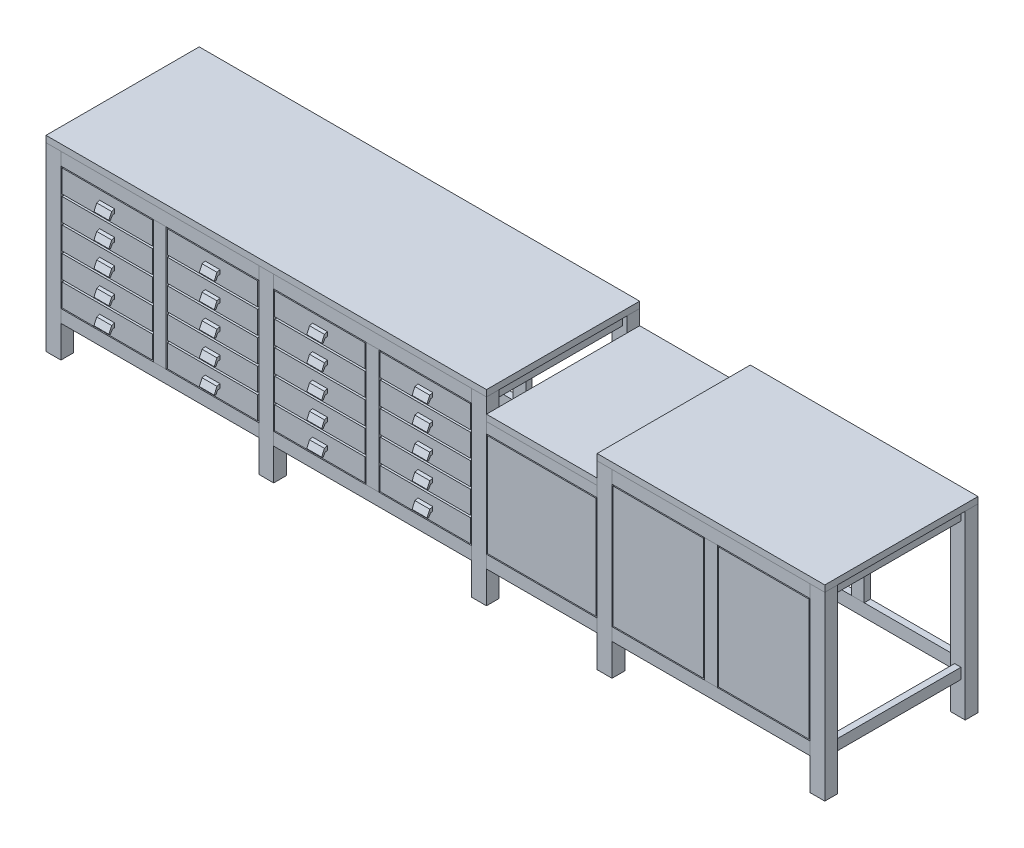
from build123d import *

# Parameters (mm, degrees)
ESQUISSE1_W             = 70
ESQUISSE1_H             = 850
BOSS_EXTRU_1_DEPTH      = 60
BOSS_EXTRU_1_2_DEPTH    = 60
BOSS_EXTRU_1_3_DEPTH    = 60
BOSS_EXTRU_1_4_DEPTH    = 60
BOSS_EXTRU_1_5_DEPTH    = 60
ESQUISSE2_W             = 930
ESQUISSE2_H             = 60
BOSS_EXTRU_2_DEPTH      = 35
BOSS_EXTRU_2_2_DEPTH    = 35
BOSS_EXTRU_2_3_DEPTH    = 35
BOSS_EXTRU_2_4_DEPTH    = 35
BOSS_EXTRU_2_5_DEPTH    = 35
BOSS_EXTRU_2_6_DEPTH    = 35
ESQUISSE2_W_2           = 520
ESQUISSE2_H_2           = 50
BOSS_EXTRU_2_7_DEPTH    = 35
BOSS_EXTRU_2_8_DEPTH    = 35
ESQUISSE3_W             = 30
ESQUISSE3_H             = 50
BOSS_EXTRU_3_DEPTH      = 600
BOSS_EXTRU_3_2_DEPTH    = 600
BOSS_EXTRU_3_3_DEPTH    = 600
BOSS_EXTRU_3_4_DEPTH    = 600
BOSS_EXTRU_3_5_DEPTH    = 600
BOSS_EXTRU_3_6_DEPTH    = 600
BOSS_EXTRU_3_7_DEPTH    = 600
BOSS_EXTRU_3_8_DEPTH    = 600
BOSS_EXTRU_3_9_DEPTH    = 600
BOSS_EXTRU_3_10_DEPTH   = 600
BOSS_EXTRU_4_START      = -600
ESQUISSE1_2_W           = 70
ESQUISSE1_2_H           = 850
BOSS_EXTRU_4_DEPTH      = 60
BOSS_EXTRU_4_2_DEPTH    = 60
BOSS_EXTRU_4_3_DEPTH    = 60
BOSS_EXTRU_4_4_DEPTH    = 60
BOSS_EXTRU_4_5_DEPTH    = 60
BOSS_EXTRU_5_START      = -720
ESQUISSE2_2_W           = 930
ESQUISSE2_2_H           = 60
BOSS_EXTRU_5_DEPTH      = 30
BOSS_EXTRU_5_2_DEPTH    = 30
BOSS_EXTRU_5_3_DEPTH    = 30
BOSS_EXTRU_5_4_DEPTH    = 30
BOSS_EXTRU_5_5_DEPTH    = 30
BOSS_EXTRU_5_6_DEPTH    = 30
ESQUISSE2_2_W_2         = 520
ESQUISSE2_2_H_2         = 50
BOSS_EXTRU_5_7_DEPTH    = 30
BOSS_EXTRU_5_8_DEPTH    = 30
ESQUISSE4_W             = 2070
ESQUISSE4_H             = 720
BOSS_EXTRU_6_DEPTH      = 30
ESQUISSE4_W_2           = 1070
BOSS_EXTRU_6_2_DEPTH    = 30
ESQUISSE5_W             = 520
ESQUISSE5_H             = 720
BOSS_EXTRU_7_DEPTH      = 30
ESQUISSE6_W             = 60
ESQUISSE6_H             = 580
BOSS_EXTRU_8_DEPTH      = 35
BOSS_EXTRU_8_2_DEPTH    = 35
BOSS_EXTRU_8_3_DEPTH    = 35
BOSS_EXTRU_10_START     = -720
ESQUISSE6_2_W           = 60
ESQUISSE6_2_H           = 580
BOSS_EXTRU_10_DEPTH     = 30
BOSS_EXTRU_10_2_DEPTH   = 30
BOSS_EXTRU_10_3_DEPTH   = 30
ESQUISSE7_W             = 425
ESQUISSE7_H             = 106
BOSS_EXTRU_11_DEPTH     = 18
BOSS_EXTRU_11_2_DEPTH   = 18
BOSS_EXTRU_11_3_DEPTH   = 18
BOSS_EXTRU_11_4_DEPTH   = 18
BOSS_EXTRU_11_5_DEPTH   = 18
BOSS_EXTRU_11_6_DEPTH   = 18
BOSS_EXTRU_11_7_DEPTH   = 18
BOSS_EXTRU_11_8_DEPTH   = 18
BOSS_EXTRU_11_9_DEPTH   = 18
BOSS_EXTRU_11_10_DEPTH  = 18
BOSS_EXTRU_11_11_DEPTH  = 18
BOSS_EXTRU_11_12_DEPTH  = 18
BOSS_EXTRU_11_13_DEPTH  = 18
BOSS_EXTRU_11_14_DEPTH  = 18
BOSS_EXTRU_11_15_DEPTH  = 18
BOSS_EXTRU_11_16_DEPTH  = 18
BOSS_EXTRU_11_17_DEPTH  = 18
BOSS_EXTRU_11_18_DEPTH  = 18
BOSS_EXTRU_11_19_DEPTH  = 18
BOSS_EXTRU_11_20_DEPTH  = 18
ESQUISSE7_W_2           = 510
ESQUISSE7_H_2           = 480
BOSS_EXTRU_11_21_DEPTH  = 18
ESQUISSE7_H_3           = 570
BOSS_EXTRU_11_22_DEPTH  = 18
BOSS_EXTRU_11_23_DEPTH  = 18
BOSS_EXTRU_12_DEPTH     = 1995
BOSS_EXTRU_12_2_DEPTH   = 1995
BOSS_EXTRU_12_3_DEPTH   = 1995
BOSS_EXTRU_12_4_DEPTH   = 1995
BOSS_EXTRU_12_5_DEPTH   = 1995
ESQUISSE9_W             = 252.5
ESQUISSE9_H             = 730
ESQUISSE9_W_2           = 425
ENL_V_MAT_EXTRU_2_DEPTH = 3833.544846443


with BuildPart() as part:
    # Esquisse1 → Boss.-Extru.1 (new body)
    with BuildSketch(Plane.XY):
        with Locations((35, 425)):
            Rectangle(ESQUISSE1_W, ESQUISSE1_H)
    extrude(amount=BOSS_EXTRU_1_DEPTH)


with BuildPart() as body_2:
    # Esquisse1 → Boss.-Extru.1 2 (new body)
    with BuildSketch(Plane.XY):
        with Locations((1035, 425)):
            Rectangle(ESQUISSE1_W, ESQUISSE1_H)
    extrude(amount=BOSS_EXTRU_1_2_DEPTH)


with BuildPart() as body_3:
    # Esquisse1 → Boss.-Extru.1 3 (new body)
    with BuildSketch(Plane.XY):
        with Locations((2035, 425)):
            Rectangle(ESQUISSE1_W, ESQUISSE1_H)
    extrude(amount=BOSS_EXTRU_1_3_DEPTH)


with BuildPart() as body_4:
    # Esquisse1 → Boss.-Extru.1 4 (new body)
    with BuildSketch(Plane.XY):
        with Locations((2625, 425)):
            Rectangle(ESQUISSE1_W, ESQUISSE1_H)
    extrude(amount=BOSS_EXTRU_1_4_DEPTH)


with BuildPart() as body_5:
    # Esquisse1 → Boss.-Extru.1 5 (new body)
    with BuildSketch(Plane.XY):
        with Locations((3625, 425)):
            Rectangle(ESQUISSE1_W, ESQUISSE1_H)
    extrude(amount=BOSS_EXTRU_1_5_DEPTH)


with BuildPart() as body_6:
    # Esquisse2 → Boss.-Extru.2 (new body)
    with BuildSketch(Plane.XY.offset(60)):
        with Locations((535, 820)):
            Rectangle(ESQUISSE2_W, ESQUISSE2_H)
    extrude(amount=-BOSS_EXTRU_2_DEPTH)


with BuildPart() as body_7:
    # Esquisse2 → Boss.-Extru.2 2 (new body)
    with BuildSketch(Plane.XY.offset(60)):
        with Locations((1535, 820)):
            Rectangle(ESQUISSE2_W, ESQUISSE2_H)
    extrude(amount=-BOSS_EXTRU_2_2_DEPTH)


with BuildPart() as body_8:
    # Esquisse2 → Boss.-Extru.2 3 (new body)
    with BuildSketch(Plane.XY.offset(60)):
        with Locations((3125, 820)):
            Rectangle(ESQUISSE2_W, ESQUISSE2_H)
    extrude(amount=-BOSS_EXTRU_2_3_DEPTH)


with BuildPart() as body_9:
    # Esquisse2 → Boss.-Extru.2 4 (new body)
    with BuildSketch(Plane.XY.offset(60)):
        with Locations((3125, 180)):
            Rectangle(ESQUISSE2_W, ESQUISSE2_H)
    extrude(amount=-BOSS_EXTRU_2_4_DEPTH)


with BuildPart() as body_10:
    # Esquisse2 → Boss.-Extru.2 5 (new body)
    with BuildSketch(Plane.XY.offset(60)):
        with Locations((1535, 180)):
            Rectangle(ESQUISSE2_W, ESQUISSE2_H)
    extrude(amount=-BOSS_EXTRU_2_5_DEPTH)


with BuildPart() as body_11:
    # Esquisse2 → Boss.-Extru.2 6 (new body)
    with BuildSketch(Plane.XY.offset(60)):
        with Locations((535, 180)):
            Rectangle(ESQUISSE2_W, ESQUISSE2_H)
    extrude(amount=-BOSS_EXTRU_2_6_DEPTH)


with BuildPart() as body_12:
    # Esquisse2 → Boss.-Extru.2 7 (new body)
    with BuildSketch(Plane.XY.offset(60)):
        with Locations((2330, 725)):
            Rectangle(ESQUISSE2_W_2, ESQUISSE2_H_2)
    extrude(amount=-BOSS_EXTRU_2_7_DEPTH)


with BuildPart() as body_13:
    # Esquisse2 → Boss.-Extru.2 8 (new body)
    with BuildSketch(Plane.XY.offset(60)):
        with Locations((2330, 180)):
            Rectangle(ESQUISSE2_W_2, ESQUISSE2_H)
    extrude(amount=-BOSS_EXTRU_2_8_DEPTH)


with BuildPart() as body_14:
    # Esquisse3 → Boss.-Extru.3 (new body)
    with BuildSketch(Plane(origin=(0, 0, 0), x_dir=(-1, 0, 0), z_dir=(0, 0, -1))):
        with Locations((-3625, 825)):
            Rectangle(ESQUISSE3_W, ESQUISSE3_H)
    extrude(amount=BOSS_EXTRU_3_DEPTH)


with BuildPart() as body_15:
    # Esquisse3 → Boss.-Extru.3 2 (new body)
    with BuildSketch(Plane(origin=(0, 0, 0), x_dir=(-1, 0, 0), z_dir=(0, 0, -1))):
        with Locations((-3625, 180)):
            Rectangle(ESQUISSE3_W, ESQUISSE3_H)
    extrude(amount=BOSS_EXTRU_3_2_DEPTH)


with BuildPart() as body_16:
    # Esquisse3 → Boss.-Extru.3 3 (new body)
    with BuildSketch(Plane(origin=(0, 0, 0), x_dir=(-1, 0, 0), z_dir=(0, 0, -1))):
        with Locations((-2625, 180)):
            Rectangle(ESQUISSE3_W, ESQUISSE3_H)
    extrude(amount=BOSS_EXTRU_3_3_DEPTH)


with BuildPart() as body_17:
    # Esquisse3 → Boss.-Extru.3 4 (new body)
    with BuildSketch(Plane(origin=(0, 0, 0), x_dir=(-1, 0, 0), z_dir=(0, 0, -1))):
        with Locations((-2625, 825)):
            Rectangle(ESQUISSE3_W, ESQUISSE3_H)
    extrude(amount=BOSS_EXTRU_3_4_DEPTH)


with BuildPart() as body_18:
    # Esquisse3 → Boss.-Extru.3 5 (new body)
    with BuildSketch(Plane(origin=(0, 0, 0), x_dir=(-1, 0, 0), z_dir=(0, 0, -1))):
        with Locations((-2035, 825)):
            Rectangle(ESQUISSE3_W, ESQUISSE3_H)
    extrude(amount=BOSS_EXTRU_3_5_DEPTH)


with BuildPart() as body_19:
    # Esquisse3 → Boss.-Extru.3 6 (new body)
    with BuildSketch(Plane(origin=(0, 0, 0), x_dir=(-1, 0, 0), z_dir=(0, 0, -1))):
        with Locations((-2035, 180)):
            Rectangle(ESQUISSE3_W, ESQUISSE3_H)
    extrude(amount=BOSS_EXTRU_3_6_DEPTH)


with BuildPart() as body_20:
    # Esquisse3 → Boss.-Extru.3 7 (new body)
    with BuildSketch(Plane(origin=(0, 0, 0), x_dir=(-1, 0, 0), z_dir=(0, 0, -1))):
        with Locations((-1035, 180)):
            Rectangle(ESQUISSE3_W, ESQUISSE3_H)
    extrude(amount=BOSS_EXTRU_3_7_DEPTH)


with BuildPart() as body_21:
    # Esquisse3 → Boss.-Extru.3 8 (new body)
    with BuildSketch(Plane(origin=(0, 0, 0), x_dir=(-1, 0, 0), z_dir=(0, 0, -1))):
        with Locations((-1035, 825)):
            Rectangle(ESQUISSE3_W, ESQUISSE3_H)
    extrude(amount=BOSS_EXTRU_3_8_DEPTH)


with BuildPart() as body_22:
    # Esquisse3 → Boss.-Extru.3 9 (new body)
    with BuildSketch(Plane(origin=(0, 0, 0), x_dir=(-1, 0, 0), z_dir=(0, 0, -1))):
        with Locations((-35, 825)):
            Rectangle(ESQUISSE3_W, ESQUISSE3_H)
    extrude(amount=BOSS_EXTRU_3_9_DEPTH)


with BuildPart() as body_23:
    # Esquisse3 → Boss.-Extru.3 10 (new body)
    with BuildSketch(Plane(origin=(0, 0, 0), x_dir=(-1, 0, 0), z_dir=(0, 0, -1))):
        with Locations((-35, 180)):
            Rectangle(ESQUISSE3_W, ESQUISSE3_H)
    extrude(amount=BOSS_EXTRU_3_10_DEPTH)


with BuildPart() as body_24:
    # Esquisse1<2> → Boss.-Extru.4 (new body)
    with BuildSketch(Plane.XY.offset(BOSS_EXTRU_4_START)):
        with Locations((35, 425)):
            Rectangle(ESQUISSE1_2_W, ESQUISSE1_2_H)
    extrude(amount=-BOSS_EXTRU_4_DEPTH)


with BuildPart() as body_25:
    # Esquisse1<2> → Boss.-Extru.4 2 (new body)
    with BuildSketch(Plane.XY.offset(BOSS_EXTRU_4_START)):
        with Locations((1035, 425)):
            Rectangle(ESQUISSE1_2_W, ESQUISSE1_2_H)
    extrude(amount=-BOSS_EXTRU_4_2_DEPTH)


with BuildPart() as body_26:
    # Esquisse1<2> → Boss.-Extru.4 3 (new body)
    with BuildSketch(Plane.XY.offset(BOSS_EXTRU_4_START)):
        with Locations((2035, 425)):
            Rectangle(ESQUISSE1_2_W, ESQUISSE1_2_H)
    extrude(amount=-BOSS_EXTRU_4_3_DEPTH)


with BuildPart() as body_27:
    # Esquisse1<2> → Boss.-Extru.4 4 (new body)
    with BuildSketch(Plane.XY.offset(BOSS_EXTRU_4_START)):
        with Locations((2625, 425)):
            Rectangle(ESQUISSE1_2_W, ESQUISSE1_2_H)
    extrude(amount=-BOSS_EXTRU_4_4_DEPTH)


with BuildPart() as body_28:
    # Esquisse1<2> → Boss.-Extru.4 5 (new body)
    with BuildSketch(Plane.XY.offset(BOSS_EXTRU_4_START)):
        with Locations((3625, 425)):
            Rectangle(ESQUISSE1_2_W, ESQUISSE1_2_H)
    extrude(amount=-BOSS_EXTRU_4_5_DEPTH)


with BuildPart() as body_29:
    # Esquisse2<2> → Boss.-Extru.5 (new body)
    with BuildSketch(Plane.XY.offset(60).offset(BOSS_EXTRU_5_START)):
        with Locations((535, 820)):
            Rectangle(ESQUISSE2_2_W, ESQUISSE2_2_H)
    extrude(amount=BOSS_EXTRU_5_DEPTH)


with BuildPart() as body_30:
    # Esquisse2<2> → Boss.-Extru.5 2 (new body)
    with BuildSketch(Plane.XY.offset(60).offset(BOSS_EXTRU_5_START)):
        with Locations((1535, 820)):
            Rectangle(ESQUISSE2_2_W, ESQUISSE2_2_H)
    extrude(amount=BOSS_EXTRU_5_2_DEPTH)


with BuildPart() as body_31:
    # Esquisse2<2> → Boss.-Extru.5 3 (new body)
    with BuildSketch(Plane.XY.offset(60).offset(BOSS_EXTRU_5_START)):
        with Locations((3125, 820)):
            Rectangle(ESQUISSE2_2_W, ESQUISSE2_2_H)
    extrude(amount=BOSS_EXTRU_5_3_DEPTH)


with BuildPart() as body_32:
    # Esquisse2<2> → Boss.-Extru.5 4 (new body)
    with BuildSketch(Plane.XY.offset(60).offset(BOSS_EXTRU_5_START)):
        with Locations((3125, 180)):
            Rectangle(ESQUISSE2_2_W, ESQUISSE2_2_H)
    extrude(amount=BOSS_EXTRU_5_4_DEPTH)


with BuildPart() as body_33:
    # Esquisse2<2> → Boss.-Extru.5 5 (new body)
    with BuildSketch(Plane.XY.offset(60).offset(BOSS_EXTRU_5_START)):
        with Locations((1535, 180)):
            Rectangle(ESQUISSE2_2_W, ESQUISSE2_2_H)
    extrude(amount=BOSS_EXTRU_5_5_DEPTH)


with BuildPart() as body_34:
    # Esquisse2<2> → Boss.-Extru.5 6 (new body)
    with BuildSketch(Plane.XY.offset(60).offset(BOSS_EXTRU_5_START)):
        with Locations((535, 180)):
            Rectangle(ESQUISSE2_2_W, ESQUISSE2_2_H)
    extrude(amount=BOSS_EXTRU_5_6_DEPTH)


with BuildPart() as body_35:
    # Esquisse2<2> → Boss.-Extru.5 7 (new body)
    with BuildSketch(Plane.XY.offset(60).offset(BOSS_EXTRU_5_START)):
        with Locations((2330, 725)):
            Rectangle(ESQUISSE2_2_W_2, ESQUISSE2_2_H_2)
    extrude(amount=BOSS_EXTRU_5_7_DEPTH)


with BuildPart() as body_36:
    # Esquisse2<2> → Boss.-Extru.5 8 (new body)
    with BuildSketch(Plane.XY.offset(60).offset(BOSS_EXTRU_5_START)):
        with Locations((2330, 180)):
            Rectangle(ESQUISSE2_2_W_2, ESQUISSE2_2_H)
    extrude(amount=BOSS_EXTRU_5_8_DEPTH)


with BuildPart() as body_37:
    # Esquisse4 → Boss.-Extru.6 (new body)
    with BuildSketch(Plane(origin=(0, 850, 0), x_dir=(1, 0, 0), z_dir=(0, 1, 0))):
        with Locations((1035, 300)):
            Rectangle(ESQUISSE4_W, ESQUISSE4_H)
    extrude(amount=BOSS_EXTRU_6_DEPTH)


with BuildPart() as body_38:
    # Esquisse4 → Boss.-Extru.6 2 (new body)
    with BuildSketch(Plane(origin=(0, 850, 0), x_dir=(1, 0, 0), z_dir=(0, 1, 0))):
        with Locations((3125, 300)):
            Rectangle(ESQUISSE4_W_2, ESQUISSE4_H)
    extrude(amount=BOSS_EXTRU_6_2_DEPTH)


with BuildPart() as body_39:
    # Esquisse5 → Boss.-Extru.7 (new body)
    with BuildSketch(Plane(origin=(0, 750, 0), x_dir=(1, 0, 0), z_dir=(0, 1, 0))):
        with Locations((2330, 300)):
            Rectangle(ESQUISSE5_W, ESQUISSE5_H)
    extrude(amount=BOSS_EXTRU_7_DEPTH)


with BuildPart() as body_40:
    # Esquisse6 → Boss.-Extru.8 (new body)
    with BuildSketch(Plane.XY.offset(60)):
        with Locations((535, 500)):
            Rectangle(ESQUISSE6_W, ESQUISSE6_H)
    extrude(amount=-BOSS_EXTRU_8_DEPTH)


with BuildPart() as body_41:
    # Esquisse6 → Boss.-Extru.8 2 (new body)
    with BuildSketch(Plane.XY.offset(60)):
        with Locations((1535, 500)):
            Rectangle(ESQUISSE6_W, ESQUISSE6_H)
    extrude(amount=-BOSS_EXTRU_8_2_DEPTH)


with BuildPart() as body_42:
    # Esquisse6 → Boss.-Extru.8 3 (new body)
    with BuildSketch(Plane.XY.offset(60)):
        with Locations((3125, 500)):
            Rectangle(ESQUISSE6_W, ESQUISSE6_H)
    extrude(amount=-BOSS_EXTRU_8_3_DEPTH)


with BuildPart() as body_43:
    # Esquisse6<2> → Boss.-Extru.10 (new body)
    with BuildSketch(Plane.XY.offset(60).offset(BOSS_EXTRU_10_START)):
        with Locations((535, 500)):
            Rectangle(ESQUISSE6_2_W, ESQUISSE6_2_H)
    extrude(amount=BOSS_EXTRU_10_DEPTH)


with BuildPart() as body_44:
    # Esquisse6<2> → Boss.-Extru.10 2 (new body)
    with BuildSketch(Plane.XY.offset(60).offset(BOSS_EXTRU_10_START)):
        with Locations((1535, 500)):
            Rectangle(ESQUISSE6_2_W, ESQUISSE6_2_H)
    extrude(amount=BOSS_EXTRU_10_2_DEPTH)


with BuildPart() as body_45:
    # Esquisse6<2> → Boss.-Extru.10 3 (new body)
    with BuildSketch(Plane.XY.offset(60).offset(BOSS_EXTRU_10_START)):
        with Locations((3125, 500)):
            Rectangle(ESQUISSE6_2_W, ESQUISSE6_2_H)
    extrude(amount=BOSS_EXTRU_10_3_DEPTH)


with BuildPart() as body_46:
    # Esquisse7 → Boss.-Extru.11 (new body)
    with BuildSketch(Plane.XY.offset(60)):
        with Locations((287.5, 268)):
            Rectangle(ESQUISSE7_W, ESQUISSE7_H)
    extrude(amount=-BOSS_EXTRU_11_DEPTH)


with BuildPart() as body_47:
    # Esquisse7 → Boss.-Extru.11 2 (new body)
    with BuildSketch(Plane.XY.offset(60)):
        with Locations((287.5, 384)):
            Rectangle(ESQUISSE7_W, ESQUISSE7_H)
    extrude(amount=-BOSS_EXTRU_11_2_DEPTH)


with BuildPart() as body_48:
    # Esquisse7 → Boss.-Extru.11 3 (new body)
    with BuildSketch(Plane.XY.offset(60)):
        with Locations((287.5, 500)):
            Rectangle(ESQUISSE7_W, ESQUISSE7_H)
    extrude(amount=-BOSS_EXTRU_11_3_DEPTH)


with BuildPart() as body_49:
    # Esquisse7 → Boss.-Extru.11 4 (new body)
    with BuildSketch(Plane.XY.offset(60)):
        with Locations((287.5, 616)):
            Rectangle(ESQUISSE7_W, ESQUISSE7_H)
    extrude(amount=-BOSS_EXTRU_11_4_DEPTH)


with BuildPart() as body_50:
    # Esquisse7 → Boss.-Extru.11 5 (new body)
    with BuildSketch(Plane.XY.offset(60)):
        with Locations((287.5, 732)):
            Rectangle(ESQUISSE7_W, ESQUISSE7_H)
    extrude(amount=-BOSS_EXTRU_11_5_DEPTH)


with BuildPart() as body_51:
    # Esquisse7 → Boss.-Extru.11 6 (new body)
    with BuildSketch(Plane.XY.offset(60)):
        with Locations((782.5, 732)):
            Rectangle(ESQUISSE7_W, ESQUISSE7_H)
    extrude(amount=-BOSS_EXTRU_11_6_DEPTH)


with BuildPart() as body_52:
    # Esquisse7 → Boss.-Extru.11 7 (new body)
    with BuildSketch(Plane.XY.offset(60)):
        with Locations((782.5, 616)):
            Rectangle(ESQUISSE7_W, ESQUISSE7_H)
    extrude(amount=-BOSS_EXTRU_11_7_DEPTH)


with BuildPart() as body_53:
    # Esquisse7 → Boss.-Extru.11 8 (new body)
    with BuildSketch(Plane.XY.offset(60)):
        with Locations((782.5, 500)):
            Rectangle(ESQUISSE7_W, ESQUISSE7_H)
    extrude(amount=-BOSS_EXTRU_11_8_DEPTH)


with BuildPart() as body_54:
    # Esquisse7 → Boss.-Extru.11 9 (new body)
    with BuildSketch(Plane.XY.offset(60)):
        with Locations((782.5, 384)):
            Rectangle(ESQUISSE7_W, ESQUISSE7_H)
    extrude(amount=-BOSS_EXTRU_11_9_DEPTH)


with BuildPart() as body_55:
    # Esquisse7 → Boss.-Extru.11 10 (new body)
    with BuildSketch(Plane.XY.offset(60)):
        with Locations((782.5, 268)):
            Rectangle(ESQUISSE7_W, ESQUISSE7_H)
    extrude(amount=-BOSS_EXTRU_11_10_DEPTH)


with BuildPart() as body_56:
    # Esquisse7 → Boss.-Extru.11 11 (new body)
    with BuildSketch(Plane.XY.offset(60)):
        with Locations((1287.5, 268)):
            Rectangle(ESQUISSE7_W, ESQUISSE7_H)
    extrude(amount=-BOSS_EXTRU_11_11_DEPTH)


with BuildPart() as body_57:
    # Esquisse7 → Boss.-Extru.11 12 (new body)
    with BuildSketch(Plane.XY.offset(60)):
        with Locations((1287.5, 384)):
            Rectangle(ESQUISSE7_W, ESQUISSE7_H)
    extrude(amount=-BOSS_EXTRU_11_12_DEPTH)


with BuildPart() as body_58:
    # Esquisse7 → Boss.-Extru.11 13 (new body)
    with BuildSketch(Plane.XY.offset(60)):
        with Locations((1287.5, 500)):
            Rectangle(ESQUISSE7_W, ESQUISSE7_H)
    extrude(amount=-BOSS_EXTRU_11_13_DEPTH)


with BuildPart() as body_59:
    # Esquisse7 → Boss.-Extru.11 14 (new body)
    with BuildSketch(Plane.XY.offset(60)):
        with Locations((1287.5, 616)):
            Rectangle(ESQUISSE7_W, ESQUISSE7_H)
    extrude(amount=-BOSS_EXTRU_11_14_DEPTH)


with BuildPart() as body_60:
    # Esquisse7 → Boss.-Extru.11 15 (new body)
    with BuildSketch(Plane.XY.offset(60)):
        with Locations((1287.5, 732)):
            Rectangle(ESQUISSE7_W, ESQUISSE7_H)
    extrude(amount=-BOSS_EXTRU_11_15_DEPTH)


with BuildPart() as body_61:
    # Esquisse7 → Boss.-Extru.11 16 (new body)
    with BuildSketch(Plane.XY.offset(60)):
        with Locations((1782.5, 732)):
            Rectangle(ESQUISSE7_W, ESQUISSE7_H)
    extrude(amount=-BOSS_EXTRU_11_16_DEPTH)


with BuildPart() as body_62:
    # Esquisse7 → Boss.-Extru.11 17 (new body)
    with BuildSketch(Plane.XY.offset(60)):
        with Locations((1782.5, 616)):
            Rectangle(ESQUISSE7_W, ESQUISSE7_H)
    extrude(amount=-BOSS_EXTRU_11_17_DEPTH)


with BuildPart() as body_63:
    # Esquisse7 → Boss.-Extru.11 18 (new body)
    with BuildSketch(Plane.XY.offset(60)):
        with Locations((1782.5, 500)):
            Rectangle(ESQUISSE7_W, ESQUISSE7_H)
    extrude(amount=-BOSS_EXTRU_11_18_DEPTH)


with BuildPart() as body_64:
    # Esquisse7 → Boss.-Extru.11 19 (new body)
    with BuildSketch(Plane.XY.offset(60)):
        with Locations((1782.5, 384)):
            Rectangle(ESQUISSE7_W, ESQUISSE7_H)
    extrude(amount=-BOSS_EXTRU_11_19_DEPTH)


with BuildPart() as body_65:
    # Esquisse7 → Boss.-Extru.11 20 (new body)
    with BuildSketch(Plane.XY.offset(60)):
        with Locations((1782.5, 268)):
            Rectangle(ESQUISSE7_W, ESQUISSE7_H)
    extrude(amount=-BOSS_EXTRU_11_20_DEPTH)


with BuildPart() as body_66:
    # Esquisse7 → Boss.-Extru.11 21 (new body)
    with BuildSketch(Plane.XY.offset(60)):
        with Locations((2330, 455)):
            Rectangle(ESQUISSE7_W_2, ESQUISSE7_H_2)
    extrude(amount=-BOSS_EXTRU_11_21_DEPTH)


with BuildPart() as body_67:
    # Esquisse7 → Boss.-Extru.11 22 (new body)
    with BuildSketch(Plane.XY.offset(60)):
        with Locations((2877.5, 500)):
            Rectangle(ESQUISSE7_W, ESQUISSE7_H_3)
    extrude(amount=-BOSS_EXTRU_11_22_DEPTH)


with BuildPart() as body_68:
    # Esquisse7 → Boss.-Extru.11 23 (new body)
    with BuildSketch(Plane.XY.offset(60)):
        with Locations((3372.5, 500)):
            Rectangle(ESQUISSE7_W, ESQUISSE7_H_3)
    extrude(amount=-BOSS_EXTRU_11_23_DEPTH)


with BuildPart() as body_69:
    # Esquisse8 → Boss.-Extru.12 (new body)
    with BuildSketch(Plane.ZY):
        Polygon((60, 722), (60, 742), (73.955997872, 738.045767761), (87.063692771, 708.853502785), (80.176805074, 704.782780756), (70, 722), align=None)
    extrude(amount=-BOSS_EXTRU_12_DEPTH)


with BuildPart() as body_70:
    # Esquisse8 → Boss.-Extru.12 2 (new body)
    with BuildSketch(Plane.ZY):
        Polygon((60, 606), (60, 626), (73.955997872, 622.045767761), (87.063692771, 592.853502785), (80.176805074, 588.782780756), (70, 606), align=None)
    extrude(amount=-BOSS_EXTRU_12_2_DEPTH)


with BuildPart() as body_71:
    # Esquisse8 → Boss.-Extru.12 3 (new body)
    with BuildSketch(Plane.ZY):
        Polygon((60, 490), (60, 510), (73.955997872, 506.045767761), (87.063692771, 476.853502785), (80.176805074, 472.782780756), (70, 490), align=None)
    extrude(amount=-BOSS_EXTRU_12_3_DEPTH)


with BuildPart() as body_72:
    # Esquisse8 → Boss.-Extru.12 4 (new body)
    with BuildSketch(Plane.ZY):
        Polygon((60, 374), (60, 394), (73.955997872, 390.045767761), (87.063692771, 360.853502785), (80.176805074, 356.782780756), (70, 374), align=None)
    extrude(amount=-BOSS_EXTRU_12_4_DEPTH)


with BuildPart() as body_73:
    # Esquisse8 → Boss.-Extru.12 5 (new body)
    with BuildSketch(Plane.ZY):
        Polygon((60, 258), (60, 278), (73.955997872, 274.045767761), (87.063692771, 244.853502785), (80.176805074, 240.782780756), (70, 258), align=None)
    extrude(amount=-BOSS_EXTRU_12_5_DEPTH)


with BuildPart() as enl_v_mat_extru_2_tool:
    # Esquisse9 → Enlèv. mat.-Extru.2 (new, through all)
    with BuildSketch(Plane.XY.offset(60)):
        with Locations((126.25, 515)):
            Rectangle(ESQUISSE9_W, ESQUISSE9_H)
        with Locations((1943.75, 515)):
            Rectangle(ESQUISSE9_W, ESQUISSE9_H)
        with Locations((1535, 515)):
            Rectangle(ESQUISSE9_W_2, ESQUISSE9_H)
        with Locations((535, 515)):
            Rectangle(ESQUISSE9_W_2, ESQUISSE9_H)
        Polygon((1035, 149.73225262), (817.5, 150), (817.5, 880), (1252.5, 880), (1252.5, 150), align=None)
    extrude(amount=ENL_V_MAT_EXTRU_2_DEPTH)


with BuildPart() as body_69_1:
    add(body_69.part)

    # Enlèv. mat.-Extru.2: cut by enl_v_mat_extru_2_tool
    add(enl_v_mat_extru_2_tool.part, mode=Mode.SUBTRACT)


with BuildPart() as body_70_1:
    add(body_70.part)

    # Enlèv. mat.-Extru.2: cut by enl_v_mat_extru_2_tool
    add(enl_v_mat_extru_2_tool.part, mode=Mode.SUBTRACT)


with BuildPart() as body_71_1:
    add(body_71.part)

    # Enlèv. mat.-Extru.2: cut by enl_v_mat_extru_2_tool
    add(enl_v_mat_extru_2_tool.part, mode=Mode.SUBTRACT)


with BuildPart() as body_72_1:
    add(body_72.part)

    # Enlèv. mat.-Extru.2: cut by enl_v_mat_extru_2_tool
    add(enl_v_mat_extru_2_tool.part, mode=Mode.SUBTRACT)


with BuildPart() as body_73_1:
    add(body_73.part)

    # Enlèv. mat.-Extru.2: cut by enl_v_mat_extru_2_tool
    add(enl_v_mat_extru_2_tool.part, mode=Mode.SUBTRACT)


solid = Compound([part.part, body_2.part, body_3.part, body_4.part, body_5.part, body_6.part, body_7.part, body_8.part, body_9.part, body_10.part, body_11.part, body_12.part, body_13.part, body_14.part, body_15.part, body_16.part, body_17.part, body_18.part, body_19.part, body_20.part, body_21.part, body_22.part, body_23.part, body_24.part, body_25.part, body_26.part, body_27.part, body_28.part, body_29.part, body_30.part, body_31.part, body_32.part, body_33.part, body_34.part, body_35.part, body_36.part, body_37.part, body_38.part, body_39.part, body_40.part, body_41.part, body_42.part, body_43.part, body_44.part, body_45.part, body_46.part, body_47.part, body_48.part, body_49.part, body_50.part, body_51.part, body_52.part, body_53.part, body_54.part, body_55.part, body_56.part, body_57.part, body_58.part, body_59.part, body_60.part, body_61.part, body_62.part, body_63.part, body_64.part, body_65.part, body_66.part, body_67.part, body_68.part, body_69_1.part, body_70_1.part, body_71_1.part, body_72_1.part, body_73_1.part])
